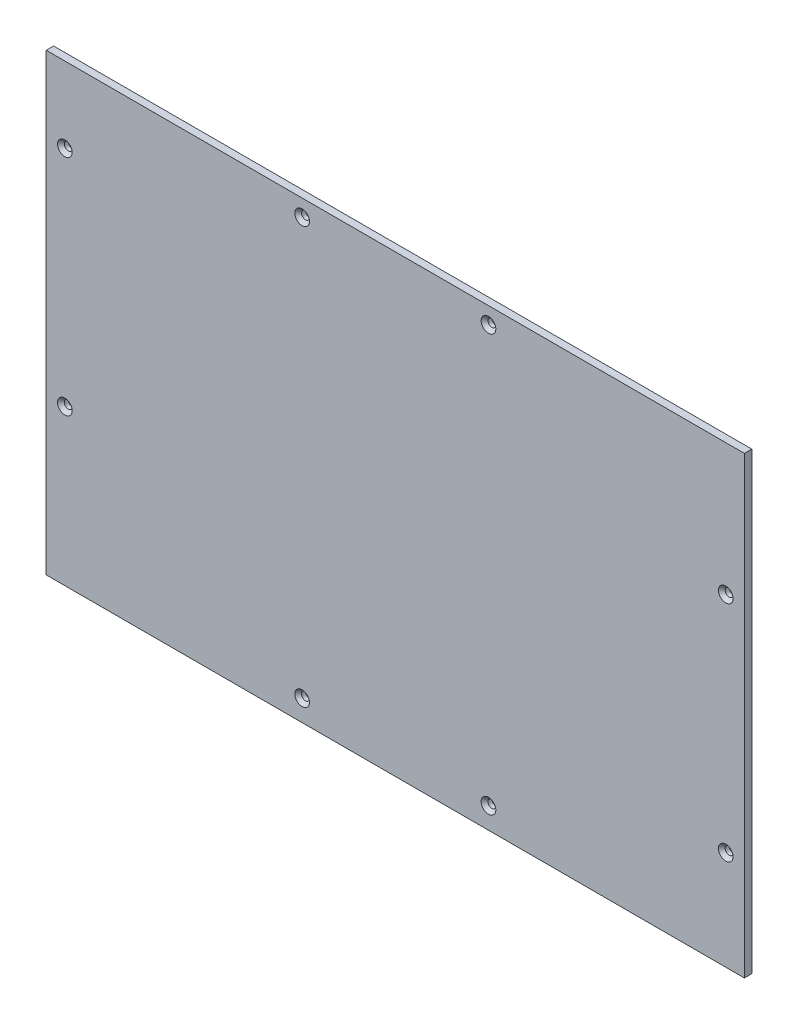
from build123d import *

# Parameters (mm, degrees)
SKETCH1_W                                       = 299.7
SKETCH1_H                                       = 195.04375
SKETCH1_R                                       = 10.775
BOSS_EXTRUDE1_DEPTH                             = 3.175
CSK_FOR_M3_FLAT_HEAD_MACHINE_SCREW1_D           = 3.4
CSK_FOR_M3_FLAT_HEAD_MACHINE_SCREW1_CSINK_D     = 6.3
CSK_FOR_M3_FLAT_HEAD_MACHINE_SCREW1_CSINK_ANGLE = 90


with BuildPart() as part:
    # Sketch1 → Boss-Extrude1 (new body)
    # profile 1 of 5: a face of its own
    with BuildSketch(Plane.XY):
        Rectangle(SKETCH1_W, SKETCH1_H)
        with Locations((-139.075, -86.746875)):
            Circle(SKETCH1_R, mode=Mode.SUBTRACT)
        with Locations((-127.075, -63.746875)):
            Circle(SKETCH1_R, mode=Mode.SUBTRACT)
    # profile 2 of 5: a face of its own
    with BuildSketch(Plane.XY):
        with Locations((-127.075, -63.746875)):
            Circle(SKETCH1_R)
    # profile 3 of 5: a face of its own
    with BuildSketch(Plane.XY):
        with Locations((-139.075, -86.746875)):
            Circle(SKETCH1_R)
    # profile 4 of 5: a face of its own
    with BuildSketch(Plane.XY):
        with BuildLine():
            ThreePointArc((-139.075, -97.521875), (-146.694075567, -94.365950567), (-149.85, -86.746875))
            Line((-149.85, -86.746875), (-149.85, -97.521875))
            Line((-149.85, -97.521875), (-139.075, -97.521875))
        make_face()
    # profile 5 of 5: a face of its own
    with BuildSketch(Plane.XY):
        Rectangle(SKETCH1_W, SKETCH1_H)
    extrude(amount=BOSS_EXTRUDE1_DEPTH)

    # CSK for M3 Flat Head Machine Screw1 (through all)
    with Locations(Plane.XY.offset(3.175)):
        with Locations((-40, 90.378125052), (40, 90.378125052), (141.850000066, 41.078125052), (141.850000066, -54.921874948), (40, -88.427624948), (-40, -88.427624948), (-141.850000066, -30.921874948), (-141.850000066, 65.078125052)):
            CounterSinkHole(CSK_FOR_M3_FLAT_HEAD_MACHINE_SCREW1_D / 2, CSK_FOR_M3_FLAT_HEAD_MACHINE_SCREW1_CSINK_D / 2, counter_sink_angle=CSK_FOR_M3_FLAT_HEAD_MACHINE_SCREW1_CSINK_ANGLE)


solid = part.part
